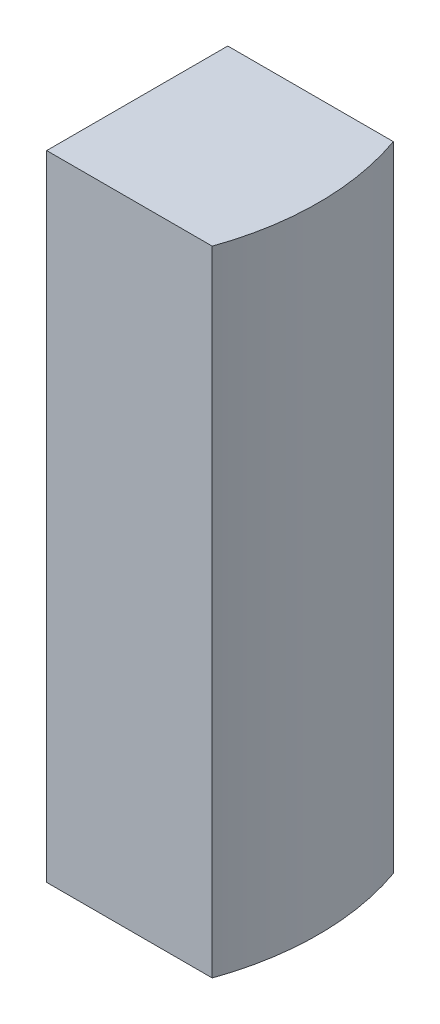
from build123d import *

# Parameters (mm, degrees)
EXTRUDE_1_DEPTH = 140


with BuildPart() as part:
    # 草图1 → 凸台-拉伸1 (new body)
    with BuildSketch(Plane(origin=(0, 0, 0), x_dir=(1, 0, 0), z_dir=(0, 1, 0))):
        with BuildLine():
            Line((20, 20), (20, -20))
            Line((20, -20), (56.568542495, -20))
            ThreePointArc((56.568542495, -20), (59.135913579, -10.146118724), (60, 0))
            ThreePointArc((60, 0), (59.135913579, 10.146118724), (56.568542495, 20))
            Line((56.568542495, 20), (20, 20))
        make_face()
    extrude(amount=EXTRUDE_1_DEPTH)


solid = part.part
